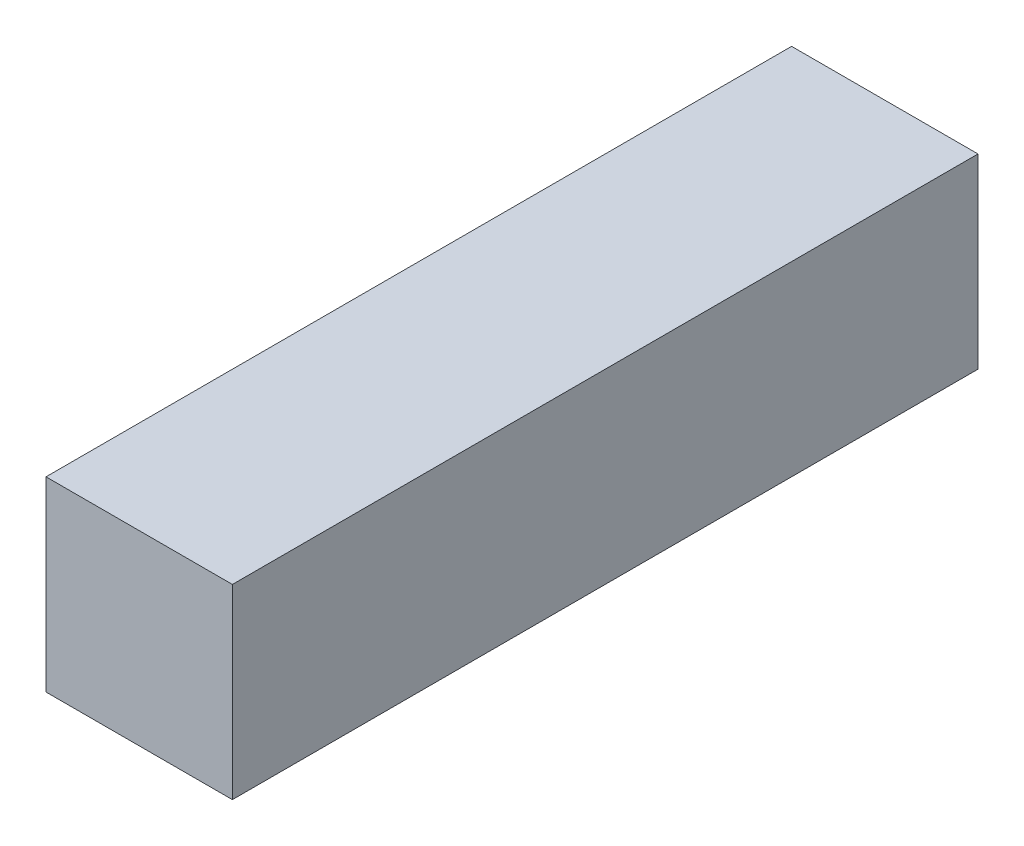
from build123d import *

# Parameters (mm, degrees)
ESBO_O1_W       = 5
ESBO_O1_H       = 5
EXTRUS_O1_DEPTH = 20


with BuildPart() as part:
    # Esboço1 → Extrusão1 (new body)
    with BuildSketch(Plane.XY):
        with Locations((2.5, 2.5)):
            Rectangle(ESBO_O1_W, ESBO_O1_H)
    extrude(amount=EXTRUS_O1_DEPTH)


solid = part.part
